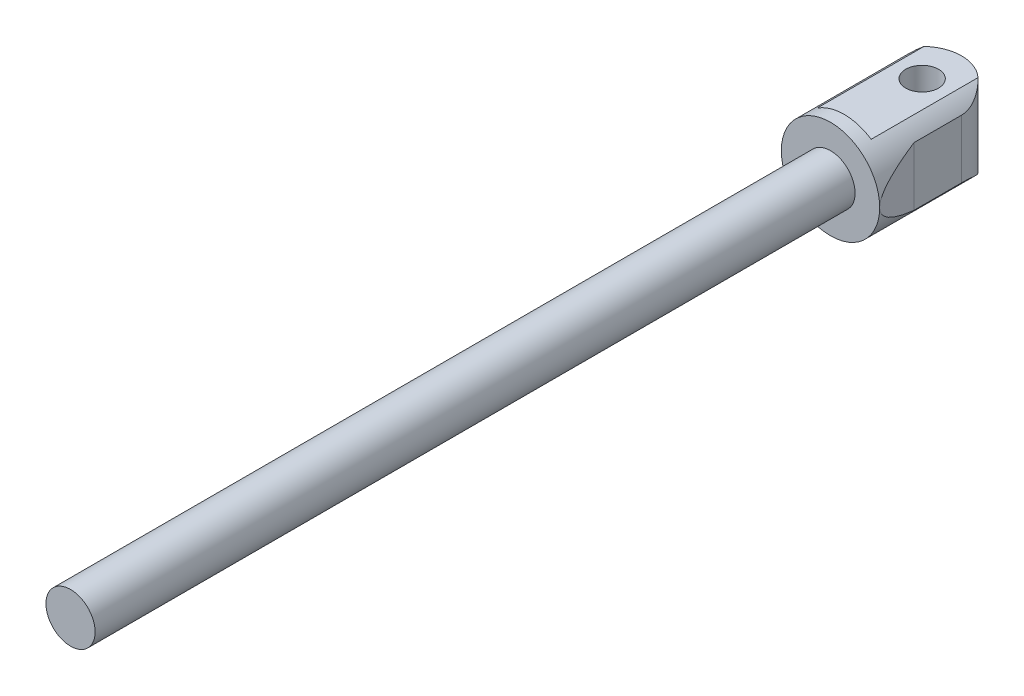
from build123d import *

# Parameters (mm, degrees)
SKETCH1_R               = 37.5
BOSS_EXTRUDE1_DEPTH     = 579.5
SKETCH2_R               = 75
BOSS_EXTRUDE2_DEPTH     = 200
CUT_EXTRUDE1_DEPTH      = 787.683068332
CUT_EXTRUDE1_DEPTH_BACK = 787.683068332
SKETCH3_R               = 25
CUT_EXTRUDE2_DEPTH      = 795.691831969
CUT_EXTRUDE2_DEPTH_BACK = 795.691831969
SKETCH5_W               = 222.214700053
SKETCH5_H               = 39.823422949


with BuildPart() as part:
    # Sketch1 → Boss-Extrude1 (new, symmetric)
    with BuildSketch(Plane.XY):
        Circle(SKETCH1_R)
    extrude(amount=BOSS_EXTRUDE1_DEPTH, both=True)

    # Sketch2 → Boss-Extrude2 (add)
    with BuildSketch(Plane(origin=(0, 0, -579.5), x_dir=(-1, 0, 0), z_dir=(0, 0, -1))):
        Circle(SKETCH2_R)
    extrude(amount=BOSS_EXTRUDE2_DEPTH)

    # Sketch3 → Cut-Extrude1 (cut, two sides: drawn at the far end of the back side and taken through both)
    with BuildSketch(Plane(origin=(0, 0, 0), x_dir=(1, 0, 0), z_dir=(0, 1, 0)).offset(-CUT_EXTRUDE1_DEPTH_BACK)):
        with Locations(Location((0, 719.26, 0), (0, 0, 270))):
            Circle(SKETCH3_R)
        with BuildLine():
            Line((75, 579.5), (60.24, 646.55))
            Line((60.24, 646.55), (60.24, 719.26))
            ThreePointArc((60.24, 719.26), (0, 779.5), (-60.24, 719.26))
            Line((-60.24, 719.26), (-60.24, 646.55))
            Line((-60.24, 646.55), (-75, 579.5))
            Line((-75, 579.5), (-116.955269632, 579.5))
            Line((-116.955269632, 579.5), (-116.955269632, 829.791162558))
            Line((-116.955269632, 829.791162558), (115.893588729, 829.791162558))
            Line((115.893588729, 829.791162558), (115.893588729, 579.5))
            Line((115.893588729, 579.5), (75, 579.5))
        make_face()
    extrude(amount=CUT_EXTRUDE1_DEPTH + CUT_EXTRUDE1_DEPTH_BACK, mode=Mode.SUBTRACT)

    # Sketch5 → Cut-Extrude2 (cut, two sides: drawn at the far end of the back side and taken through both)
    with BuildSketch(Plane.ZY.offset(60.24).offset(-CUT_EXTRUDE2_DEPTH_BACK)):
        with Locations((-711.467350027, 82.581711474)):
            Rectangle(SKETCH5_W, SKETCH5_H)
        with Locations((-711.467350027, -82.581711474)):
            Rectangle(SKETCH5_W, SKETCH5_H)
    extrude(amount=CUT_EXTRUDE2_DEPTH + CUT_EXTRUDE2_DEPTH_BACK, mode=Mode.SUBTRACT)


solid = part.part
